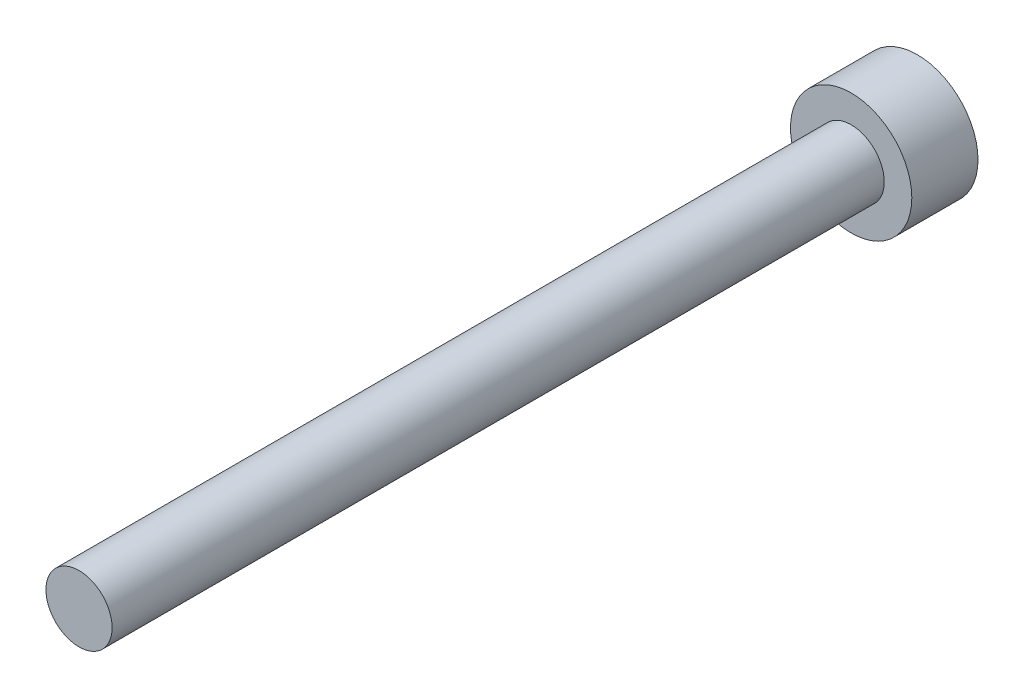
from build123d import *

# Parameters (mm, degrees)
CABEZA_START            = -3
CROQUIS1_R              = 2.75
CABEZA_DEPTH            = 3
CROQUIS2_R              = 1.5
CUERPO_DEPTH            = 35
HEXAGONO_INTERIOR_START = -3
HEXAGONO_INTERIOR_DEPTH = 1.3


with BuildPart() as part:
    # Croquis1 → Cabeza (new body)
    with BuildSketch(Plane.XY.offset(CABEZA_START)):
        Circle(CROQUIS1_R)
    extrude(amount=CABEZA_DEPTH)

    # Croquis2 → Cuerpo (add)
    with BuildSketch(Plane.XY):
        Circle(CROQUIS2_R)
    extrude(amount=CUERPO_DEPTH)

    # Croquis3 → Hexagono_interior (cut)
    with BuildSketch(Plane.XY.offset(HEXAGONO_INTERIOR_START)):
        Polygon((1.443375673, 0), (0.721687836, 1.25), (-0.721687836, 1.25), (-1.443375673, 0), (-0.721687836, -1.25), (0.721687836, -1.25), align=None)
    extrude(amount=HEXAGONO_INTERIOR_DEPTH, mode=Mode.SUBTRACT)


solid = part.part
